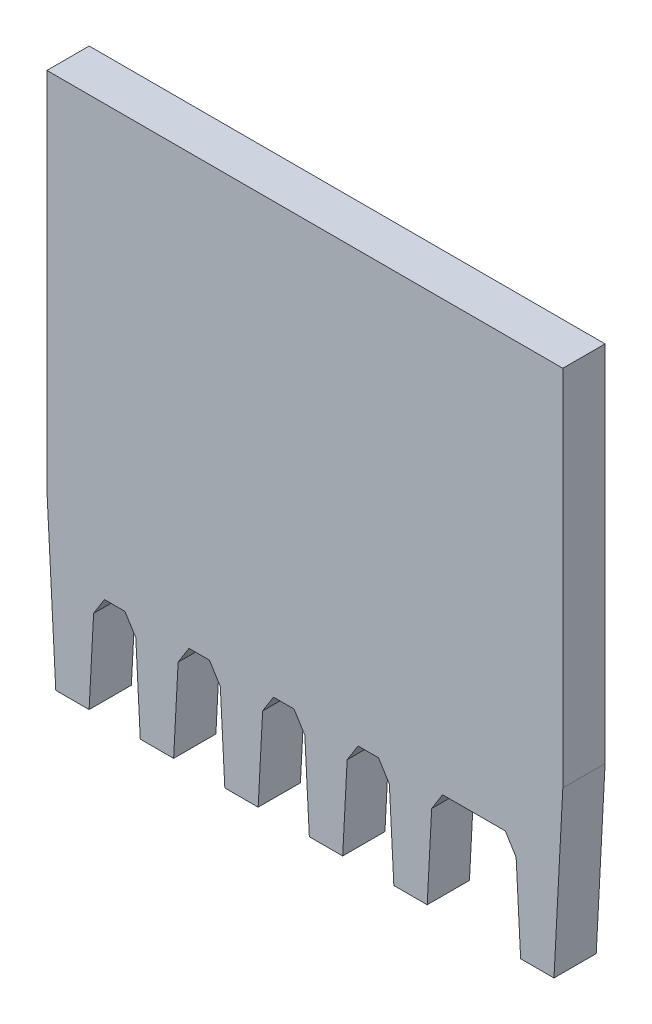
from build123d import *

# Parameters (mm, degrees)
BOSS_EXTRUDE1_DEPTH = 1.5


with BuildPart() as part:
    # Sketch1 → Boss-Extrude1 (new body)
    with BuildSketch(Plane.XY):
        Polygon((0, 6), (0.314446676, 0), (1.497941481, 0), (1.657221927, 3.039251967), (2.042586863, 3.65596478), (2.769801294, 3.65596478), (3.155166229, 3.039251967), (3.314446676, 0), (4.497941481, 0), (4.657221927, 3.039251967), (5.042586863, 3.65596478), (5.769801294, 3.65596478), (6.155166229, 3.039251967), (6.314446676, 0), (7.497941481, 0), (7.657221927, 3.039251967), (8.042586863, 3.65596478), (8.769801294, 3.65596478), (9.155166229, 3.039251967), (9.314446676, 0), (10.497941481, 0), (10.657221927, 3.039251967), (11.042586863, 3.65596478), (11.769801294, 3.65596478), (12.155166229, 3.039251967), (12.314446676, 0), (13.497941481, 0), (13.657221927, 3.039251967), (14.042586863, 3.65596478), (16.269801294, 3.65596478), (16.655166229, 3.039251967), (16.814446676, 0), (17.997941481, 0), (18.312388157, 6), (18.312388157, 18.9), (0, 18.9), align=None)
    extrude(amount=BOSS_EXTRUDE1_DEPTH)


solid = part.part
